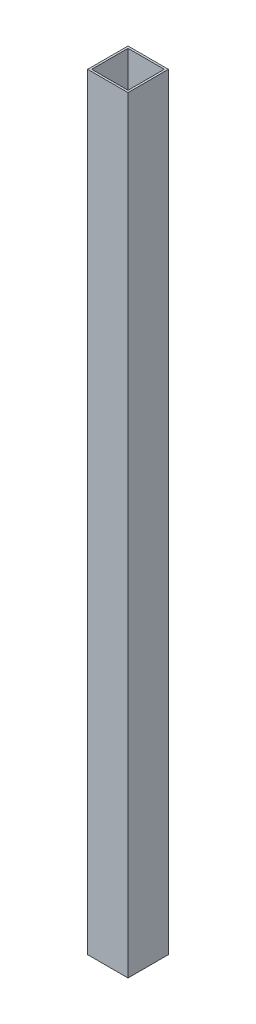
from build123d import *

# Parameters (mm, degrees)
SKETCH1_W           = 25.4
SKETCH1_H           = 25.4
BOSS_EXTRUDE1_DEPTH = 482.6
SKETCH2_R           = 2.54
CUT_EXTRUDE1_DEPTH  = 2.54


with BuildPart() as part:
    # Sketch1 → Boss-Extrude1 (new body)
    with BuildSketch(Plane(origin=(0, 0, 0), x_dir=(1, 0, 0), z_dir=(0, 1, 0))):
        with Locations((12.7, 12.7)):
            Rectangle(SKETCH1_W, SKETCH1_H)
        Polygon((1.27, 12.361459156), (1.27, 24.13), (12.7, 24.13), (24.13, 24.13), (24.13, 12.7), (24.13, 1.27), (12.7, 1.27), (1.27, 1.27), align=None, mode=Mode.SUBTRACT)
    extrude(amount=BOSS_EXTRUDE1_DEPTH)

    # Sketch2 → Cut-Extrude1 (cut)
    with BuildSketch(Plane(origin=(0, 0, -25.4), x_dir=(-1, 0, 0), z_dir=(0, 0, -1))):
        with Locations((-12.7, 50.874750115)):
            Circle(SKETCH2_R)
    extrude(amount=-CUT_EXTRUDE1_DEPTH, mode=Mode.SUBTRACT)


solid = part.part
